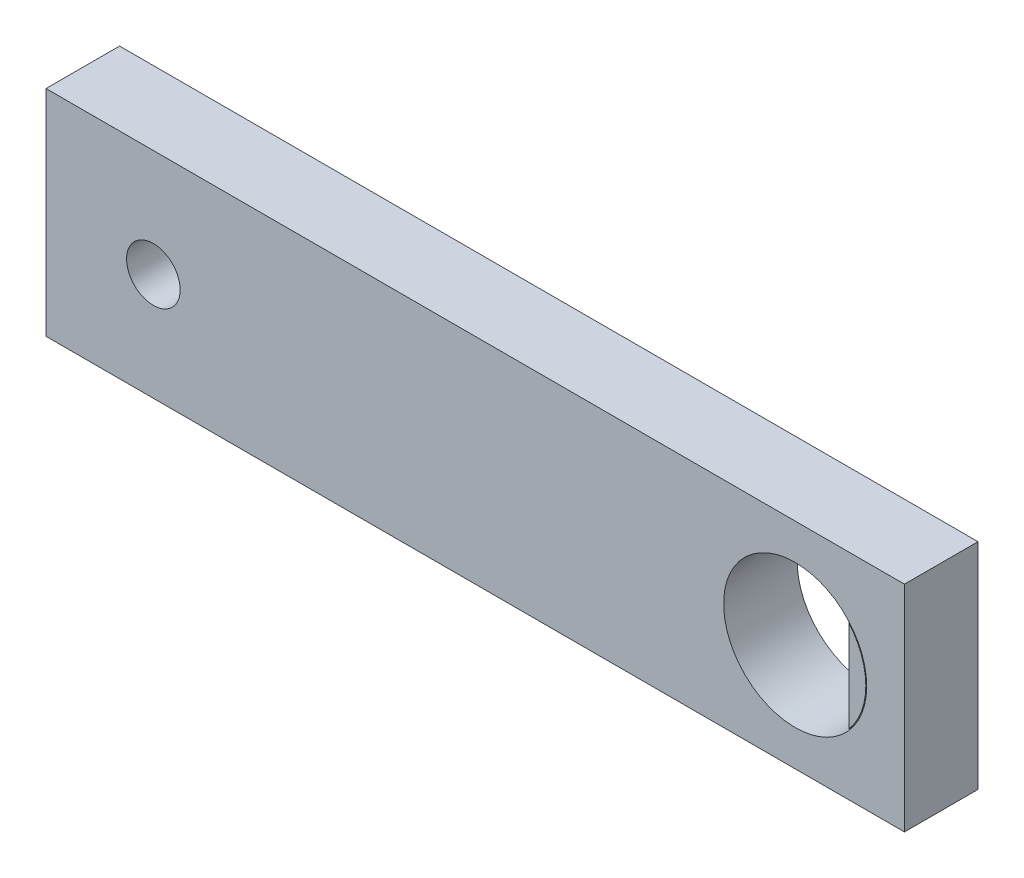
from build123d import *

# Parameters (mm, degrees)
SKETCH1_W           = 76.2
SKETCH1_H           = 19.05
SKETCH1_R           = 2.38
SKETCH1_R_2         = 6.35
BOSS_EXTRUDE1_DEPTH = 6.53
BOSS_EXTRUDE2_DEPTH = 6.35


with BuildPart() as part:
    # Sketch1 → Boss-Extrude1 (new body)
    with BuildSketch(Plane.XY):
        Rectangle(SKETCH1_W, SKETCH1_H)
        with Locations((-28.57, 0)):
            Circle(SKETCH1_R, mode=Mode.SUBTRACT)
        with Locations((28.4, 0)):
            Circle(SKETCH1_R_2, mode=Mode.SUBTRACT)
    extrude(amount=BOSS_EXTRUDE1_DEPTH)


with BuildPart() as body_2:
    # Sketch2 → Boss-Extrude2 (new body)
    with BuildSketch(Plane.XY.offset(6.53)):
        with BuildLine():
            ThreePointArc((34.671845471, 0), (34.281752717, 2.177390775), (33.16, 4.08392527))
            Line((33.16, 4.08392527), (33.16, -4.08392527))
            ThreePointArc((33.16, -4.08392527), (34.281752717, -2.177390775), (34.671845471, 0))
        make_face()
    extrude(amount=-BOSS_EXTRUDE2_DEPTH)


solid = Compound([part.part, body_2.part])
